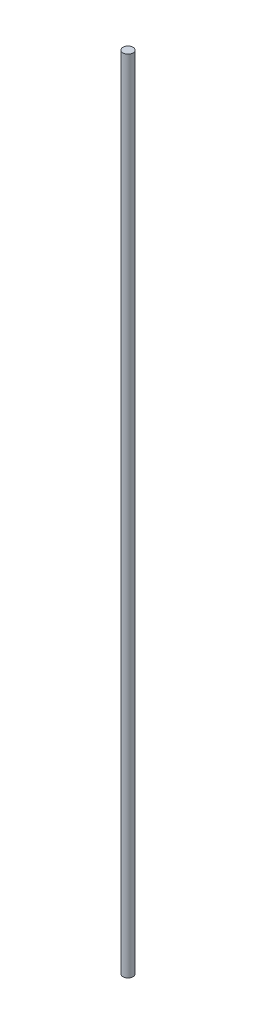
from build123d import *

# Parameters (mm, degrees)
SKETCH_1_R      = 2.5
EXTRUDE_1_DEPTH = 400


with BuildPart() as part:
    # 草图1 → 凸台-拉伸1 (new body)
    with BuildSketch(Plane(origin=(0, 0, 0), x_dir=(1, 0, 0), z_dir=(0, 1, 0))):
        with Locations(Location((0, 0, 0), (0, 0, 270))):
            Circle(SKETCH_1_R)
    extrude(amount=EXTRUDE_1_DEPTH)


solid = part.part
